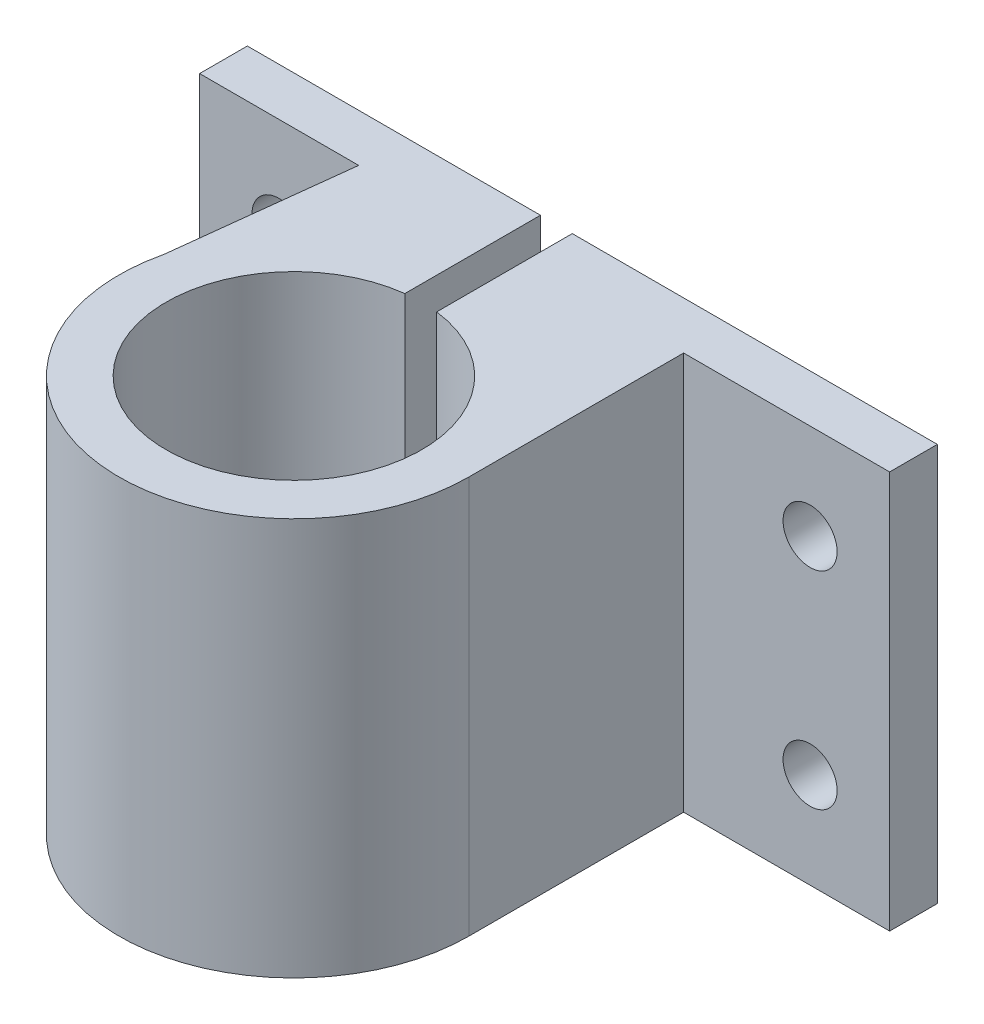
from build123d import *

# Parameters (mm, degrees)
BOSS_EXTRUDE1_DEPTH = 25
SKETCH4_R           = 1.7
CUT_EXTRUDE1_DEPTH  = 10


with BuildPart() as part:
    # Sketch3 → Boss-Extrude1 (new body)
    with BuildSketch(Plane(origin=(0, 235.92362241, 0), x_dir=(1, 0, 0), z_dir=(0, 1, 0))):
        with BuildLine():
            Line((193.646317651, -3), (203.646317651, -3))
            Line((203.646317651, -3), (202.368284032, -13.971630503))
            ThreePointArc((202.368284032, -13.971630503), (211.801033564, -27.426122447), (224.073766164, -16.5))
            Line((224.073766164, -16.5), (224.073766164, -3))
            Line((224.073766164, -3), (237.023766163, -3))
            Line((237.023766163, -3), (237.023766163, 0))
            Line((237.023766163, 0), (214.073766164, 0))
            Line((214.073766164, 0), (214.073766164, -8.524180623))
            ThreePointArc((214.073766164, -8.524180623), (213.073766164, -24.53826441), (212.073766164, -8.524180623))
            Line((212.073766164, -8.524180623), (212.073766164, 0))
            Line((212.073766164, 0), (193.646317651, 0))
            Line((193.646317651, 0), (193.646317651, -3))
        make_face()
    extrude(amount=-BOSS_EXTRUDE1_DEPTH)

    # Sketch4 → Cut-Extrude1 (cut)
    with BuildSketch(Plane.XY.offset(3)):
        with BuildLine():
            ThreePointArc((198.637476239, 231.62362241), (196.937476239, 229.92362241), (198.637476239, 228.22362241))
            Line((198.637476239, 228.22362241), (198.637476239, 231.62362241))
        make_face()
        with BuildLine():
            Line((198.637476239, 231.62362241), (198.637476239, 228.22362241))
            ThreePointArc((198.637476239, 228.22362241), (199.839557767, 228.721540882), (200.337476239, 229.92362241))
            ThreePointArc((200.337476239, 229.92362241), (199.839557767, 231.125703938), (198.637476239, 231.62362241))
        make_face()
        with BuildLine():
            ThreePointArc((198.637476239, 218.62362241), (196.937476239, 216.92362241), (198.637476239, 215.22362241))
            Line((198.637476239, 215.22362241), (198.637476239, 218.62362241))
        make_face()
        with BuildLine():
            Line((198.637476239, 218.62362241), (198.637476239, 215.22362241))
            ThreePointArc((198.637476239, 215.22362241), (199.839557767, 215.721540882), (200.337476239, 216.92362241))
            ThreePointArc((200.337476239, 216.92362241), (199.839557767, 218.125703938), (198.637476239, 218.62362241))
        make_face()
        with Locations((232.023766163, 229.92362241)):
            Circle(SKETCH4_R)
        with Locations((232.023766163, 216.92362241)):
            Circle(SKETCH4_R)
    extrude(amount=-CUT_EXTRUDE1_DEPTH, mode=Mode.SUBTRACT)


solid = part.part
